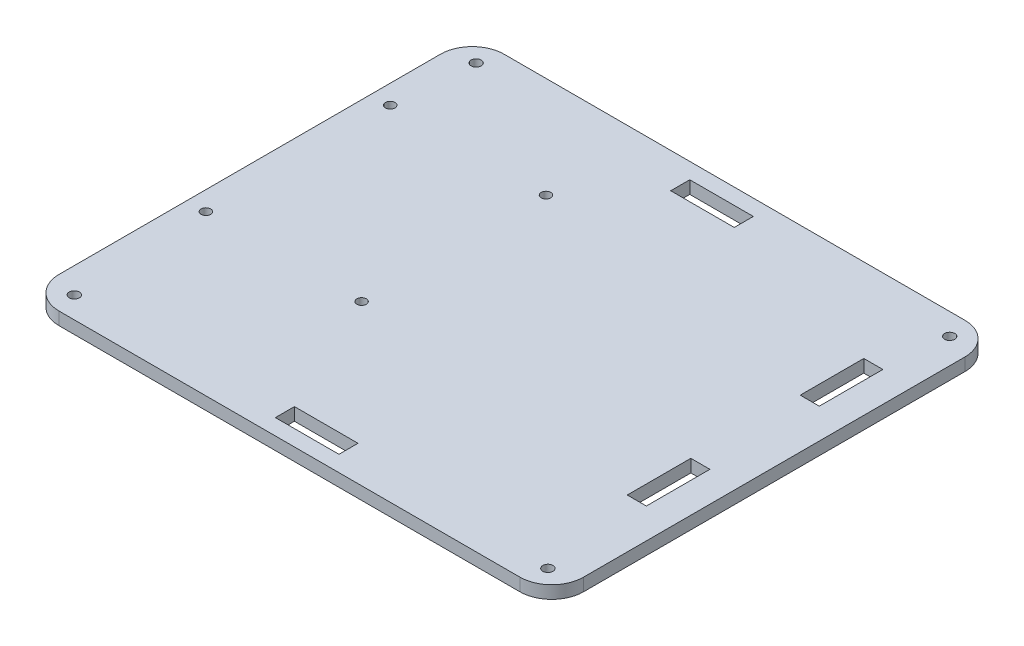
from build123d import *

# Parameters (mm, degrees)
SKETCH1_W           = 165
SKETCH1_H           = 140
BOSS_EXTRUDE1_DEPTH = 4
SKETCH2_R           = 1.6
CUT_EXTRUDE1_DEPTH  = 10
FILLET1_R           = 10
SKETCH3_R           = 1.5
CUT_EXTRUDE2_DEPTH  = 10
SKETCH4_W           = 6
SKETCH4_H           = 20
SKETCH4_W_2         = 20
SKETCH4_H_2         = 6
CUT_EXTRUDE3_DEPTH  = 10


with BuildPart() as part:
    # Sketch1 → Boss-Extrude1 (new body)
    with BuildSketch(Plane(origin=(0, 0, 0), x_dir=(1, 0, 0), z_dir=(0, 1, 0))):
        Rectangle(SKETCH1_W, SKETCH1_H)
    extrude(amount=BOSS_EXTRUDE1_DEPTH)

    # Sketch2 → Cut-Extrude1 (cut)
    with BuildSketch(Plane(origin=(0, 4, 0), x_dir=(1, 0, 0), z_dir=(0, 1, 0))):
        with Locations(Location((-74.5, 63.212121212, 0), (0, 0, 270))):
            Circle(SKETCH2_R)
        with Locations(Location((-74.5, -63.212121212, 0), (0, 0, 270))):
            Circle(SKETCH2_R)
        with Locations(Location((74.5, -63.212121212, 0), (0, 0, 270))):
            Circle(SKETCH2_R)
        with Locations(Location((74.5, 63.212121212, 0), (0, 0, 270))):
            Circle(SKETCH2_R)
    extrude(amount=-CUT_EXTRUDE1_DEPTH, mode=Mode.SUBTRACT)

    # Fillet1
    fillet1_edges = [part.edges().sort_by_distance(p)[0] for p in [
        (82.5, 2, 70),
        (-82.5, 2, 70),
        (-82.5, 2, -70),
        (82.5, 2, -70),
    ]]
    fillet(fillet1_edges, radius=FILLET1_R)

    # Sketch3 → Cut-Extrude2 (cut)
    with BuildSketch(Plane(origin=(0, 4, 0), x_dir=(1, 0, 0), z_dir=(0, 1, 0))):
        with Locations(Location((-76.5, 38.189224362, 0), (0, 0, 270))):
            Circle(SKETCH3_R)
        with Locations(Location((-27.5, 38.189224362, 0), (0, 0, 270))):
            Circle(SKETCH3_R)
        with Locations(Location((-76.5, -19.810775638, 0), (0, 0, 270))):
            Circle(SKETCH3_R)
        with Locations(Location((-27.5, -19.810775638, 0), (0, 0, 270))):
            Circle(SKETCH3_R)
    extrude(amount=-CUT_EXTRUDE2_DEPTH, mode=Mode.SUBTRACT)

    # Sketch4 → Cut-Extrude3 (cut)
    with BuildSketch(Plane(origin=(0, 4, 0), x_dir=(1, 0, 0), z_dir=(0, 1, 0))):
        with Locations((70, 33.680953207)):
            Rectangle(SKETCH4_W, SKETCH4_H)
        with Locations((70, -20.735149517)):
            Rectangle(SKETCH4_W, SKETCH4_H)
        with Locations((0.550060732, -62)):
            Rectangle(SKETCH4_W_2, SKETCH4_H_2)
        with Locations((0.930649546, 62)):
            Rectangle(SKETCH4_W_2, SKETCH4_H_2)
    extrude(amount=-CUT_EXTRUDE3_DEPTH, mode=Mode.SUBTRACT)


solid = part.part
